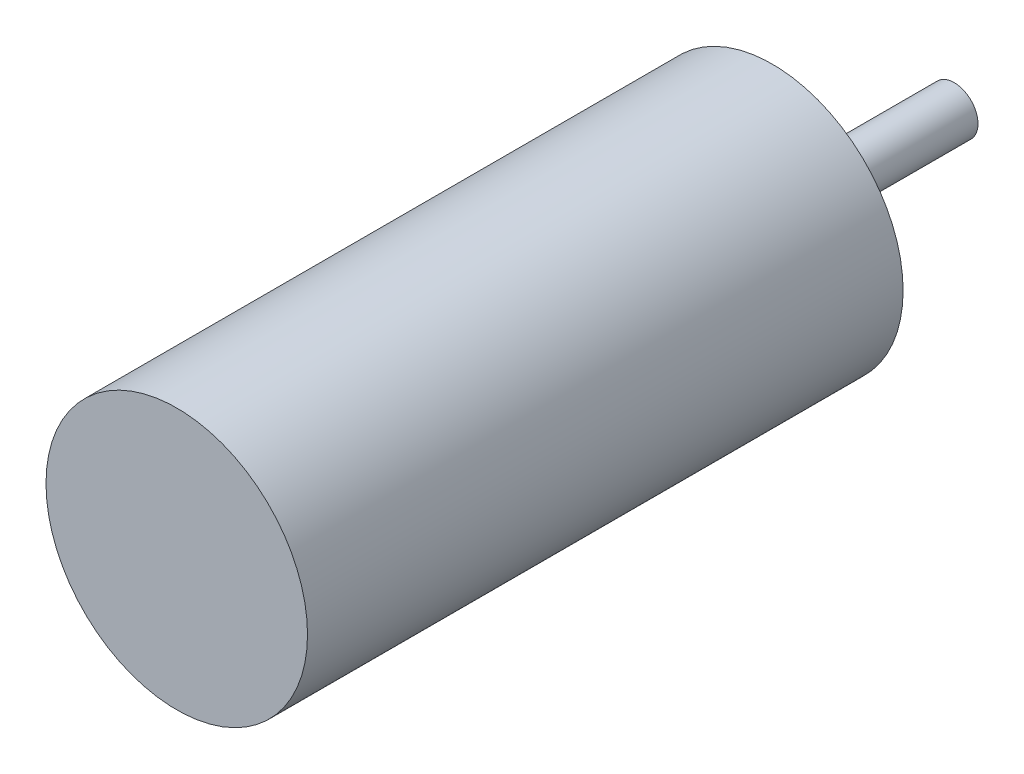
from build123d import *

# Parameters (mm, degrees)
SKETCH1_R           = 11
BOSS_EXTRUDE4_DEPTH = 50.1
SKETCH1_6_R         = 2
BOSS_EXTRUDE5_DEPTH = 15.3


with BuildPart() as part:
    # Sketch1 → Boss-Extrude4 (new body)
    with BuildSketch(Plane.XY):
        Circle(SKETCH1_R)
    extrude(amount=BOSS_EXTRUDE4_DEPTH)

    # Sketch1<6> → Boss-Extrude5 (add)
    with BuildSketch(Plane.XY):
        Circle(SKETCH1_6_R)
    extrude(amount=-BOSS_EXTRUDE5_DEPTH)


solid = part.part
